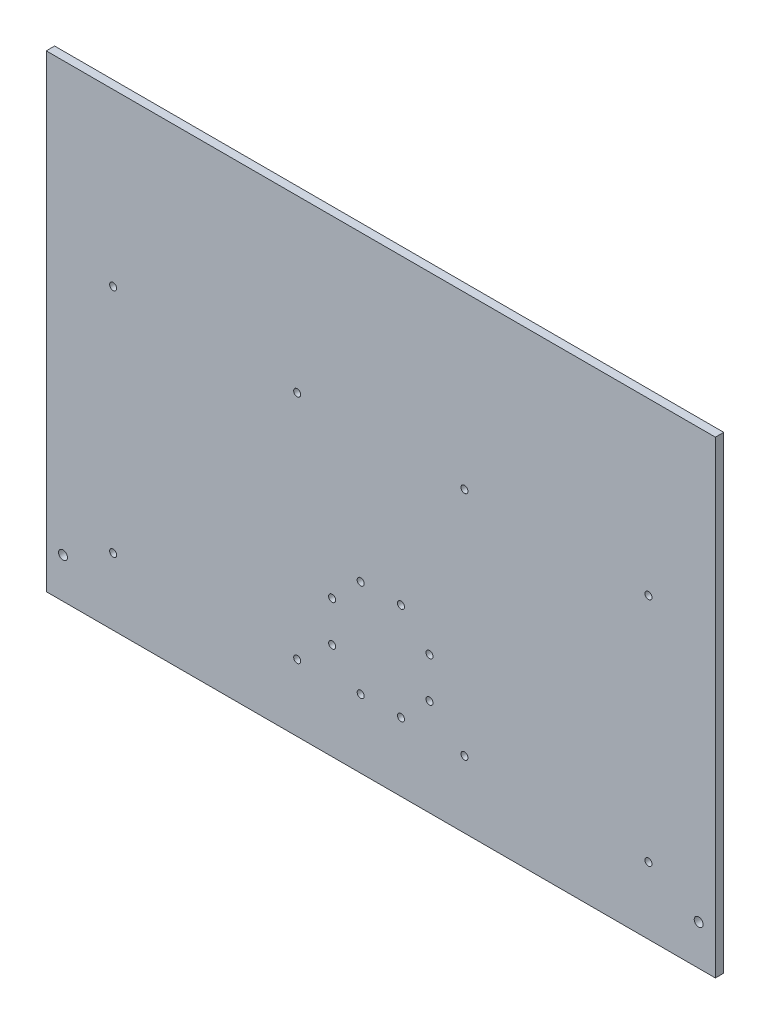
from build123d import *

# Parameters (mm, degrees)
ESBO_O1_W                    = 400
ESBO_O1_H                    = 280
RESSALTO_EXTRUS_O1_DEPTH     = 5
FURO_DE_DI_METRO_4_2_4_2_2_D = 4.2
FURO_DE_DI_METRO_5_3_5_3_1_D = 5.3
FURO_DE_DI_METRO_4_2_4_2_1_D = 4.2


with BuildPart() as part:
    # Esboço1 → Ressalto-extrusão1 (new body)
    with BuildSketch(Plane.XY):
        Rectangle(ESBO_O1_W, ESBO_O1_H)
    extrude(amount=RESSALTO_EXTRUS_O1_DEPTH)

    # Furo de diâmetro Ø4.2 (4.2)2 (through all)
    with Locations(Plane(origin=(12.05452812, -40.897794726, 5), x_dir=(1, 0, 0), z_dir=(0, 0, 1))):
        with Locations((0, 0), (17.047677154, -17.047677154), (17.047677154, -41.156733393), (0, -58.204410548), (-24.109056239, -58.204410548), (-41.156733394, -41.156733394), (-41.156733394, -17.047677155), (-24.109056239, 0)):
            Hole(FURO_DE_DI_METRO_4_2_4_2_2_D / 2)

    # Furo de diâmetro Ø5.3 (5.3)1 (through all)
    with Locations(Plane(origin=(-190, -116, 5), x_dir=(1, 0, 0), z_dir=(0, 0, 1))):
        with Locations((0, 0), (380, 0)):
            Hole(FURO_DE_DI_METRO_5_3_5_3_1_D / 2)

    # Furo de diâmetro Ø4.2 (4.2)1 (through all)
    with Locations(Plane(origin=(-160, 38, 5), x_dir=(1, 0, 0), z_dir=(0, 0, 1))):
        with Locations((0, 0), (110, 0), (210, 0), (320, 0), (320, -138), (210, -138), (110, -138), (0, -138)):
            Hole(FURO_DE_DI_METRO_4_2_4_2_1_D / 2)


solid = part.part
